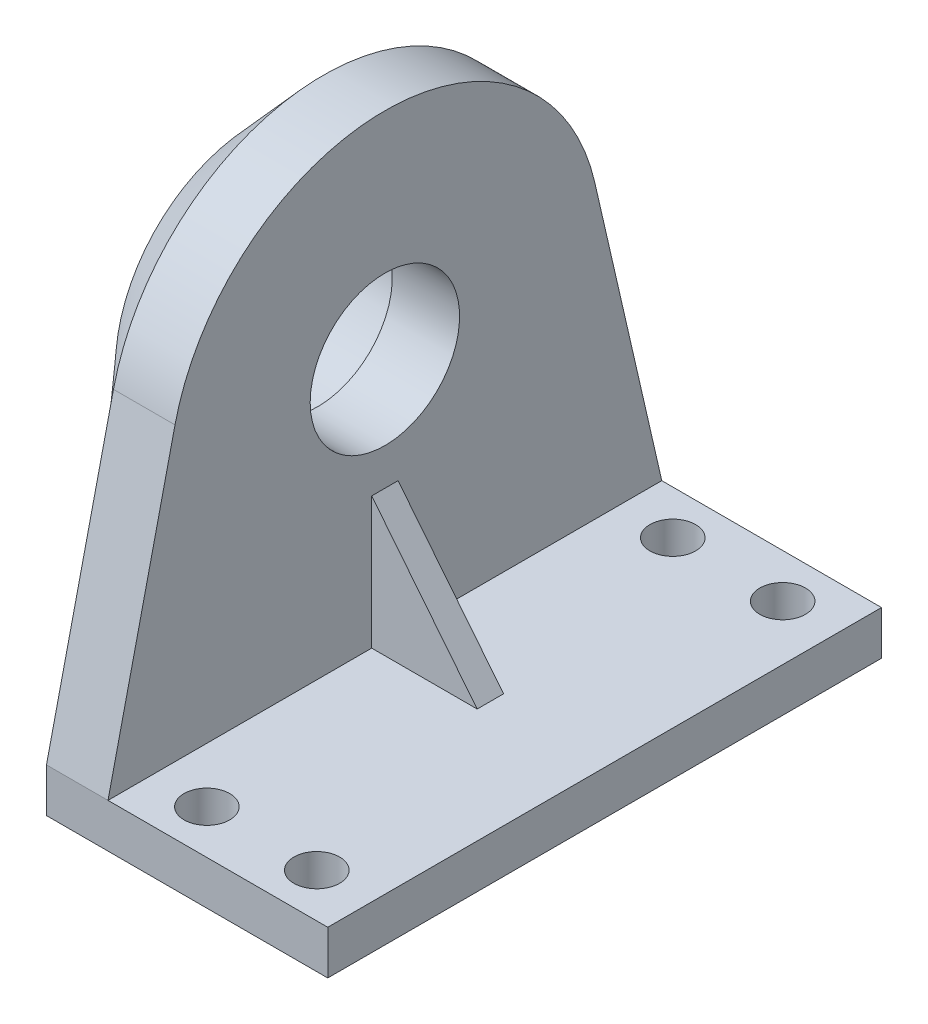
from build123d import *

# Parameters (mm, degrees)
BOSS_EXTRUDE1_START = -7
BOSS_EXTRUDE1_DEPTH = 7
SKETCH6_W           = 63
SKETCH6_H           = 5
BOSS_EXTRUDE2_DEPTH = 25
SKETCH7_R           = 2.6
CUT_EXTRUDE1_DEPTH  = 73.728844744
BOSS_EXTRUDE3_DEPTH = 1.5


with BuildPart() as part:
    # Sketch4 → Revolve1 (revolve)
    with BuildSketch(Plane.XY, mode=Mode.PRIVATE) as revolve1_sk:
        Polygon((0, 11), (7, 11), (7, 8.5), (14.653434377, 8.5), (14.653434377, 24.5), (7.653434377, 24.5), (0, 16), align=None)
    revolve(revolve1_sk.sketch.rotate(Axis((0, 0, 0), (1, 0, 0)), 90), axis=Axis((0, 0, 0), (1, 0, 0)))

    # Sketch5 → Boss-Extrude1 (add)
    with BuildSketch(Plane(origin=(14.653434377, 0, 0), x_dir=(0, 0, -1), z_dir=(1, 0, 0)).offset(BOSS_EXTRUDE1_START)):
        with BuildLine():
            Line((-31.5, -32.7), (31.5, -32.7))
            Line((31.5, -32.7), (31.5, -27.7))
            Line((31.5, -27.7), (23.878278615, 5.484324057))
            ThreePointArc((23.878278615, 5.484324057), (0, -24.5), (-23.878278615, 5.484324057))
            Line((-23.878278615, 5.484324057), (-31.5, -27.7))
            Line((-31.5, -27.7), (-31.5, -32.7))
        make_face()
    extrude(amount=BOSS_EXTRUDE1_DEPTH)

    # Sketch6 → Boss-Extrude2 (add)
    with BuildSketch(Plane(origin=(14.653434377, 0, 0), x_dir=(0, 0, -1), z_dir=(1, 0, 0))):
        with Locations((0, -30.2)):
            Rectangle(SKETCH6_W, SKETCH6_H)
    extrude(amount=BOSS_EXTRUDE2_DEPTH)

    # Sketch7 → Cut-Extrude1 (cut, through all)
    with BuildSketch(Plane(origin=(0, -27.7, 0), x_dir=(1, 0, 0), z_dir=(0, 1, 0))):
        with Locations(Location((20.903434377, 26.5, 0), (0, 0, 270))):
            Circle(SKETCH7_R)
        with Locations(Location((33.403434377, 26.5, 0), (0, 0, 270))):
            Circle(SKETCH7_R)
        with Locations(Location((33.403434377, -26.5, 0), (0, 0, 270))):
            Circle(SKETCH7_R)
        with Locations(Location((20.903434377, -26.5, 0), (0, 0, 270))):
            Circle(SKETCH7_R)
    extrude(amount=-CUT_EXTRUDE1_DEPTH, mode=Mode.SUBTRACT)

    # Sketch8 → Boss-Extrude3 (add, symmetric)
    with BuildSketch(Plane.XY):
        Polygon((26.653434377, -27.7), (14.653434377, -12.7), (14.653434377, -27.7), align=None)
    extrude(amount=BOSS_EXTRUDE3_DEPTH, both=True)


solid = part.part
